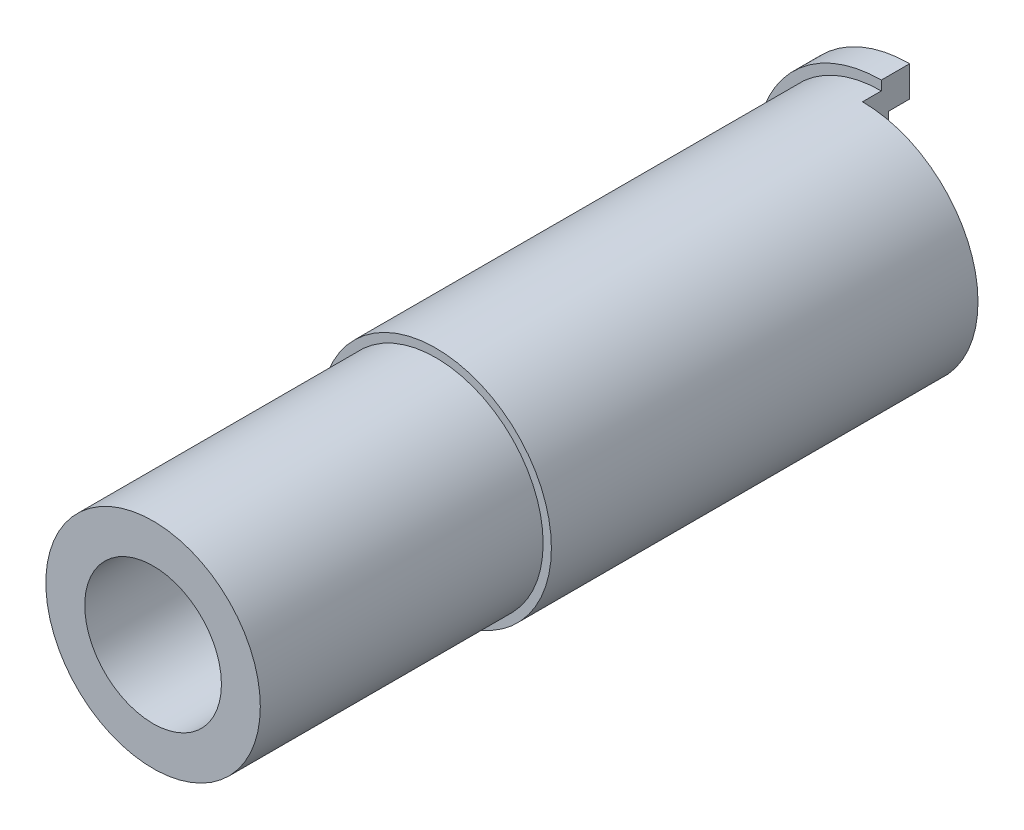
from build123d import *

# Parameters (mm, degrees)
ESQUISSE1_R             = 4.55
ESQUISSE1_R_2           = 2.9
BOSS_EXTRU_1_DEPTH      = 12
BOSS_EXTRU_2_START      = -19.2
ESQUISSE1_3_R           = 4.9
ESQUISSE1_3_R_2         = 2.9
BOSS_EXTRU_2_DEPTH      = 19.2
ESQUISSE2_W             = 6.768135737
ESQUISSE2_H             = 1.1
ENL_V_MAT_EXTRU_1_DEPTH = 5
R_VOLUTION1_ANGLE       = 180


with BuildPart() as part:
    # Esquisse1 → Boss.-Extru.1 (new body)
    with BuildSketch(Plane.XY):
        Circle(ESQUISSE1_R)
        Circle(ESQUISSE1_R_2, mode=Mode.SUBTRACT)
    extrude(amount=BOSS_EXTRU_1_DEPTH)

    # Esquisse1<3> → Boss.-Extru.2 (add)
    with BuildSketch(Plane.XY.offset(BOSS_EXTRU_2_START)):
        Circle(ESQUISSE1_3_R)
        Circle(ESQUISSE1_3_R_2, mode=Mode.SUBTRACT)
    extrude(amount=BOSS_EXTRU_2_DEPTH)

    # Esquisse2 → Enlèv. mat.-Extru.1 (cut, symmetric)
    with BuildSketch(Plane(origin=(0, 0, 0), x_dir=(1, 0, 0), z_dir=(0, 1, 0))):
        with Locations((3.384067869, 18.65)):
            Rectangle(ESQUISSE2_W, ESQUISSE2_H)
    extrude(amount=ENL_V_MAT_EXTRU_1_DEPTH, both=True, mode=Mode.SUBTRACT)

    # Esquisse3 → Révolution1 (revolve)
    with BuildSketch(Plane(origin=(0, 0, 0), x_dir=(0, 0, -1), z_dir=(1, 0, 0))):
        Polygon((18.9, -4.9), (19.2, -4.9), (19.2, -4), (20.1, -4), (20.1, -5.3), (18.9, -5.3), align=None)
    revolve(axis=Axis((0, 0, 0), (0, 0, -1)), revolution_arc=R_VOLUTION1_ANGLE)


solid = part.part
